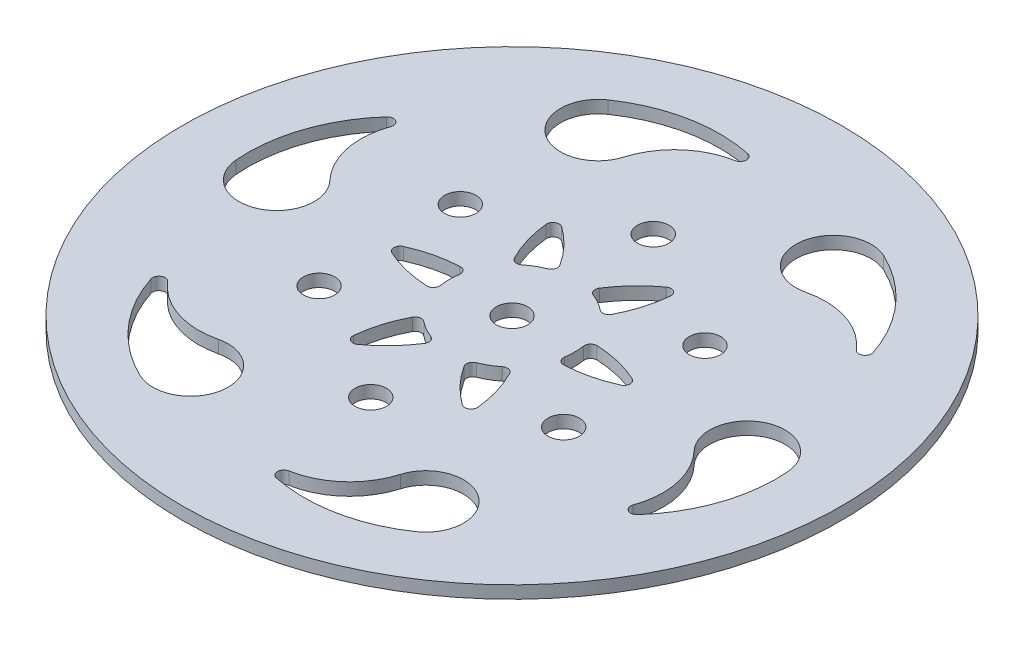
from build123d import *

# Parameters (mm, degrees)
SKETCH_1_R          = 52.5
SKETCH_1_R_2        = 2.5
EXTRUDE_1_DEPTH     = 2
SKETCH_2_R          = 2.5
CUT_EXTRUDE_1_DEPTH = 75.273144541
CUT_EXTRUDE_2_DEPTH = 75.273144541
FILLET_1_R          = 1


with BuildPart() as part:
    # 草图1 → 凸台-拉伸1 (new body)
    with BuildSketch(Plane(origin=(0, 0, 0), x_dir=(1, 0, 0), z_dir=(0, 1, 0))):
        with Locations(Location((0, 0, 0), (0, 0, 270))):
            Circle(SKETCH_1_R)
        with Locations(Location((0, 0, 0), (0, 0, 270))):
            Circle(SKETCH_1_R_2, mode=Mode.SUBTRACT)
    extrude(amount=EXTRUDE_1_DEPTH)

    # 草图2 → 切除-拉伸1 (cut, through all)
    with BuildSketch(Plane(origin=(0, 2, 0), x_dir=(1, 0, 0), z_dir=(0, 1, 0))):
        with Locations(Location((0, 22.5, 0), (0, 0, 270))):
            Circle(SKETCH_2_R)
        with Locations(Location((19.485571585, 11.25, 0), (0, 0, 270))):
            Circle(SKETCH_2_R)
        with Locations(Location((19.485571585, -11.25, 0), (0, 0, 270))):
            Circle(SKETCH_2_R)
        with Locations(Location((0, -22.5, 0), (0, 0, 270))):
            Circle(SKETCH_2_R)
        with Locations(Location((-19.485571585, -11.25, 0), (0, 0, 270))):
            Circle(SKETCH_2_R)
        with Locations(Location((-19.485571585, 11.25, 0), (0, 0, 270))):
            Circle(SKETCH_2_R)
    extrude(amount=-CUT_EXTRUDE_1_DEPTH, mode=Mode.SUBTRACT)

    # 草图3 → 切除-拉伸2 (cut, through all)
    with BuildSketch(Plane(origin=(0, 2, 0), x_dir=(1, 0, 0), z_dir=(0, 1, 0))):
        with BuildLine():
            ThreePointArc((-22.155602008, 37.41577804), (-22.27211138, 27.618511811), (-12.996323739, 30.774421131))
            ThreePointArc((-12.996323739, 30.774421131), (-9.500367402, 36.305423878), (-3.622483775, 39.180173636))
            ThreePointArc((-3.622483775, 39.180173636), (-2.800378137, 40.149983716), (-3.594497467, 41.142840081))
            ThreePointArc((-3.594497467, 41.142840081), (-13.258070622, 41.186787552), (-22.155602008, 37.41577804))
        make_face()
        with BuildLine():
            ThreePointArc((21.325213281, 37.895203195), (12.782277153, 33.097470157), (20.153268617, 26.642357079))
            ThreePointArc((20.153268617, 26.642357079), (26.691235672, 26.380271454), (32.119783806, 22.727249792))
            ThreePointArc((32.119783806, 22.727249792), (33.370716791, 22.500190465), (33.833495961, 23.684346161))
            ThreePointArc((33.833495961, 23.684346161), (29.039769009, 32.075219739), (21.325213281, 37.895203195))
        make_face()
        with BuildLine():
            ThreePointArc((43.480815289, 0.479425154), (35.054388533, 5.478958346), (33.149592355, -4.132064052))
            ThreePointArc((33.149592355, -4.132064052), (36.191603074, -9.925152424), (35.742267581, -16.452923844))
            ThreePointArc((35.742267581, -16.452923844), (36.171094928, -17.649793251), (37.427993428, -17.45849392))
            ThreePointArc((37.427993428, -17.45849392), (42.297839631, -9.111567812), (43.480815289, 0.479425154))
        make_face()
        with BuildLine():
            ThreePointArc((22.155602008, -37.41577804), (22.27211138, -27.618511811), (12.996323739, -30.774421131))
            ThreePointArc((12.996323739, -30.774421131), (9.500367402, -36.305423878), (3.622483775, -39.180173636))
            ThreePointArc((3.622483775, -39.180173636), (2.800378137, -40.149983716), (3.594497467, -41.142840081))
            ThreePointArc((3.594497467, -41.142840081), (13.258070622, -41.186787552), (22.155602008, -37.41577804))
        make_face()
        with BuildLine():
            ThreePointArc((-21.325213281, -37.895203195), (-12.782277153, -33.097470157), (-20.153268617, -26.642357079))
            ThreePointArc((-20.153268617, -26.642357079), (-26.691235672, -26.380271454), (-32.119783806, -22.727249792))
            ThreePointArc((-32.119783806, -22.727249792), (-33.370716791, -22.500190465), (-33.833495961, -23.684346161))
            ThreePointArc((-33.833495961, -23.684346161), (-29.039769009, -32.075219739), (-21.325213281, -37.895203195))
        make_face()
        with BuildLine():
            ThreePointArc((-43.480815289, -0.479425154), (-35.054388533, -5.478958346), (-33.149592355, 4.132064052))
            ThreePointArc((-33.149592355, 4.132064052), (-36.191603074, 9.925152424), (-35.742267581, 16.452923844))
            ThreePointArc((-35.742267581, 16.452923844), (-36.171094928, 17.649793251), (-37.427993428, 17.45849392))
            ThreePointArc((-37.427993428, 17.45849392), (-42.297839631, 9.111567812), (-43.480815289, -0.479425154))
        make_face()
        with BuildLine():
            ThreePointArc((-2.5, 9.682458366), (-5, 8.660254038), (-7.135254916, 7.006292692))
            ThreePointArc((-7.135254916, 7.006292692), (-9.270509831, 11.968176729), (-10, 17.320508076))
            ThreePointArc((-10, 17.320508076), (-5.729490169, 14.012585384), (-2.5, 9.682458366))
        make_face()
        with BuildLine():
            ThreePointArc((2.5, 9.682458366), (5.729490169, 14.012585384), (10, 17.320508076))
            ThreePointArc((10, 17.320508076), (9.270509831, 11.968176729), (7.135254916, 7.006292692))
            ThreePointArc((7.135254916, 7.006292692), (5, 8.660254038), (2.5, 9.682458366))
        make_face()
        with BuildLine():
            ThreePointArc((9.635254916, 2.676165673), (15, 2.044408655), (20, 0))
            ThreePointArc((20, 0), (15, -2.044408655), (9.635254916, -2.676165673))
            ThreePointArc((9.635254916, -2.676165673), (10, 0), (9.635254916, 2.676165673))
        make_face()
        with BuildLine():
            ThreePointArc((7.135254916, -7.006292692), (9.270509831, -11.968176729), (10, -17.320508076))
            ThreePointArc((10, -17.320508076), (5.729490169, -14.012585384), (2.5, -9.682458366))
            ThreePointArc((2.5, -9.682458366), (5, -8.660254038), (7.135254916, -7.006292692))
        make_face()
        with BuildLine():
            ThreePointArc((-2.5, -9.682458366), (-5.729490169, -14.012585384), (-10, -17.320508076))
            ThreePointArc((-10, -17.320508076), (-9.270509831, -11.968176729), (-7.135254916, -7.006292692))
            ThreePointArc((-7.135254916, -7.006292692), (-5, -8.660254038), (-2.5, -9.682458366))
        make_face()
        with BuildLine():
            ThreePointArc((-9.635254916, -2.676165673), (-15, -2.044408655), (-20, 0))
            ThreePointArc((-20, 0), (-15, 2.044408655), (-9.635254916, 2.676165673))
            ThreePointArc((-9.635254916, 2.676165673), (-10, 0), (-9.635254916, -2.676165673))
        make_face()
    extrude(amount=-CUT_EXTRUDE_2_DEPTH, mode=Mode.SUBTRACT)

    # 圆角1
    fillet_1_edges = [part.edges().sort_by_distance(p)[0] for p in [
        (9.635254916, 1, 2.676165673),
        (9.635254916, 1, -2.676165673),
        (20, 1, 0),
        (-7.135254916, 1, -7.006292692),
        (-10, 1, -17.320508076),
        (-2.5, 1, -9.682458366),
        (7.135254916, 1, -7.006292692),
        (2.5, 1, -9.682458366),
        (10, 1, -17.320508076),
        (2.5, 1, 9.682458366),
        (7.135254916, 1, 7.006292692),
        (10, 1, 17.320508076),
        (-7.135254916, 1, 7.006292692),
        (-2.5, 1, 9.682458366),
        (-10, 1, 17.320508076),
        (-9.635254916, 1, -2.676165673),
        (-9.635254916, 1, 2.676165673),
        (-20, 1, 0),
    ]]
    fillet(fillet_1_edges, radius=FILLET_1_R)


solid = part.part
